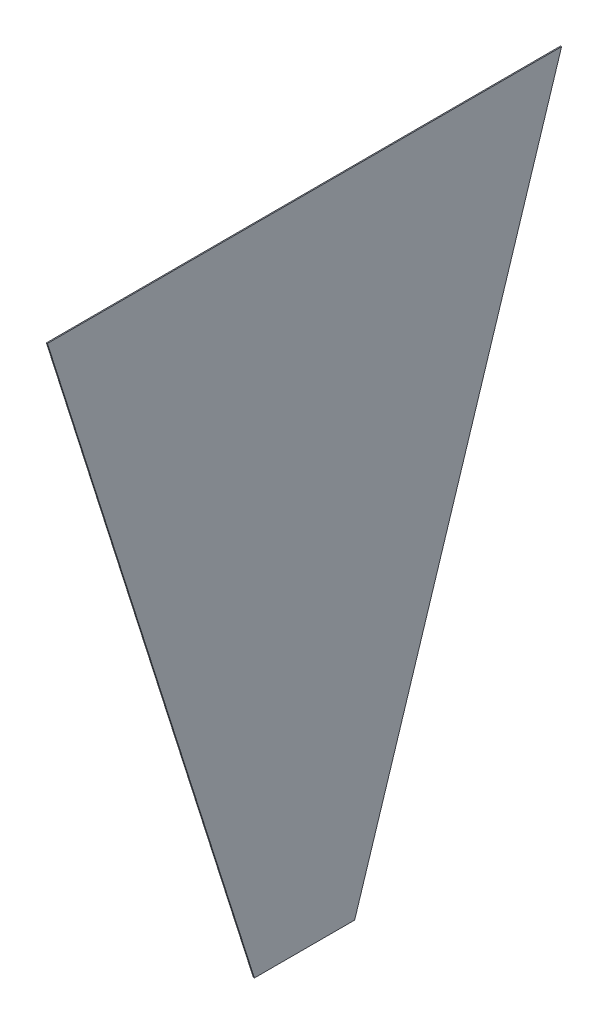
from build123d import *

# Parameters (mm, degrees)
BOSS_EXTRUDE1_DEPTH = 1.22


with BuildPart() as part:
    # Sketch1 → Boss-Extrude1 (new body)
    with BuildSketch(Plane(origin=(0, 0, 0), x_dir=(0, 0, -1), z_dir=(1, 0, 0))):
        Polygon((-300, 381), (300, 381), (58.5, -381), (0, -381), (-58.5, -381), align=None)
    extrude(amount=BOSS_EXTRUDE1_DEPTH)


solid = part.part
